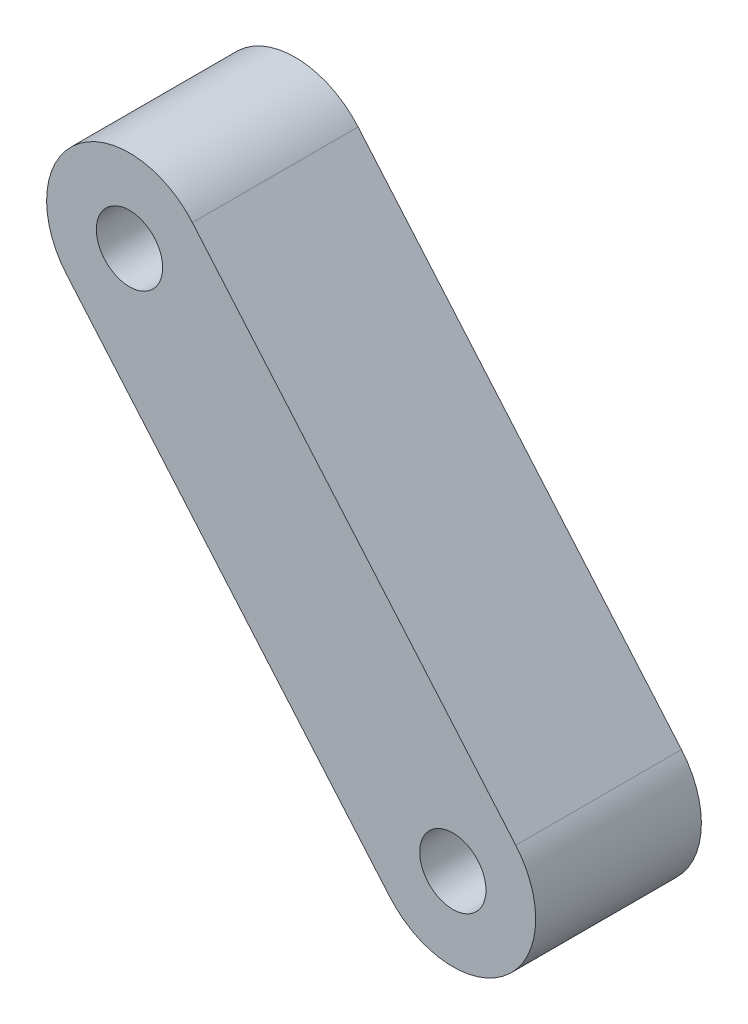
from build123d import *

# Parameters (mm, degrees)
SKETCH1_R           = 2
BOSS_EXTRUDE1_DEPTH = 10


with BuildPart() as part:
    # Sketch1 → Boss-Extrude1 (new body)
    with BuildSketch(Plane.XY):
        with BuildLine():
            Line((42.202504105, 6.747458697), (22.687256286, 29.532434066))
            ThreePointArc((22.687256286, 29.532434066), (23.232210878, 36.582471264), (30.282248076, 36.037516672))
            Line((30.282248076, 36.037516672), (49.797495895, 13.252541303))
            ThreePointArc((49.797495895, 13.252541303), (49.252541303, 6.202504105), (42.202504105, 6.747458697))
        make_face()
        with Locations((26.484752181, 32.784975369)):
            Circle(SKETCH1_R, mode=Mode.SUBTRACT)
        with Locations((46, 10)):
            Circle(SKETCH1_R, mode=Mode.SUBTRACT)
    extrude(amount=BOSS_EXTRUDE1_DEPTH)


solid = part.part
